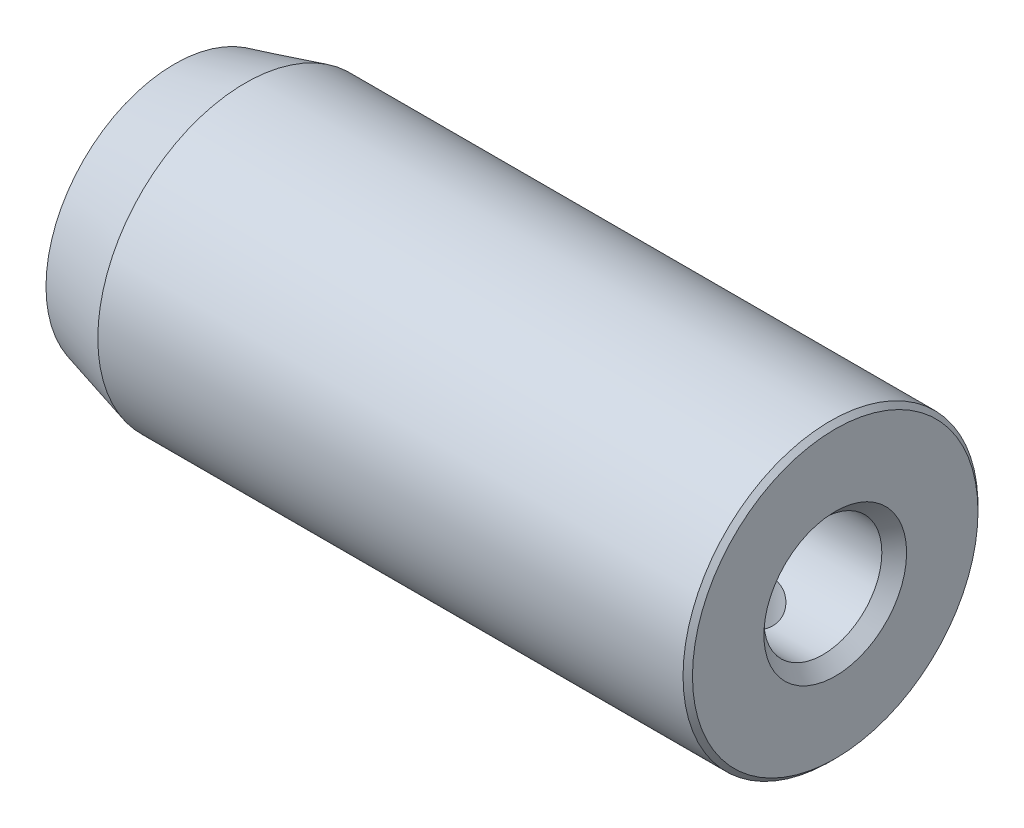
from build123d import *

# Parameters (mm, degrees)
FURO_ROSCADO_DE_M61_D           = 5
FURO_ROSCADO_DE_M61_CSINK_D     = 6.05
FURO_ROSCADO_DE_M61_CSINK_ANGLE = 90
CHANFRO1_SIZE                   = 0.2
CHANFRO3_SIZE                   = 3
CHANFRO3_SIZE2                  = 0.803847577
CORTE_EXTRUS_O1_REACH           = 31.306
CORTE_EXTRUS_O1_END_RADIUS      = 6.25
ESBO_O7_R                       = 1.35


with BuildPart() as part:
    # Esboço1 → Revolução1 (revolve)
    with BuildSketch(Plane(origin=(0, 0, 0), x_dir=(1, 0, 0), z_dir=(0, 1, 0)), mode=Mode.PRIVATE) as revolu_o1_sk:
        Polygon((-0.058940995, 6.25), (27.941059005, 6.25), (27.941059005, 0), (19.941059005, 0), (19.941059005, 5), (-0.058940995, 5), align=None)
    revolve(revolu_o1_sk.sketch.rotate(Axis((0, 0, 0), (1, 0, 0)), 180), axis=Axis((0, 0, 0), (1, 0, 0)))

    # Furo roscado de M61 (through all)
    with Locations(Plane(origin=(27.941059005, 0, 0), x_dir=(0, 0, -1), z_dir=(1, 0, 0))):
        with Locations((0, 0)):
            CounterSinkHole(FURO_ROSCADO_DE_M61_D / 2, FURO_ROSCADO_DE_M61_CSINK_D / 2, counter_sink_angle=FURO_ROSCADO_DE_M61_CSINK_ANGLE)

    # Chanfro1
    chanfro1_edges = [part.edges().sort_by_distance(p)[0] for p in [
        (27.941059005, 0, -6.25),
    ]]
    chamfer(chanfro1_edges, length=CHANFRO1_SIZE)

    # Chanfro3
    chanfro3_edges = [part.edges().sort_by_distance(p)[0] for p in [
        (-0.058940995, 0, -6.25),
    ]]
    chanfro3_side = [part.faces().sort_by_distance(p)[0] for p in [
        (13.841059005, 0, -6.25),
    ]]
    chamfer(chanfro3_edges, length=CHANFRO3_SIZE, length2=CHANFRO3_SIZE2, reference=chanfro3_side[0])

    # Corte-extrusão1: up to this cylinder (the profile starts inside it)
    corte_extrus_o1_end = Plane(origin=(23.941059, 0, 0), z_dir=(-1, 0, 0)) * Cylinder(CORTE_EXTRUS_O1_END_RADIUS, 76.112, mode=Mode.PRIVATE)
    # Esboço7 → Corte-extrusão1 (cut, up to the surface)
    with BuildSketch(Plane(origin=(0, 0, 0), x_dir=(1, 0, 0), z_dir=(0, 1, 0)), mode=Mode.PRIVATE) as corte_extrus_o1_sk1:
        with Locations(Location((23.941059005, 0, 0), (0, 0, 270))):
            Circle(ESBO_O7_R)
    corte_extrus_o1_tool1 = extrude(corte_extrus_o1_sk1.sketch, amount=-CORTE_EXTRUS_O1_REACH, mode=Mode.PRIVATE) & corte_extrus_o1_end
    add(corte_extrus_o1_tool1.solids().sort_by_distance((23.941059, 0, 0))[0], mode=Mode.SUBTRACT)


solid = part.part
